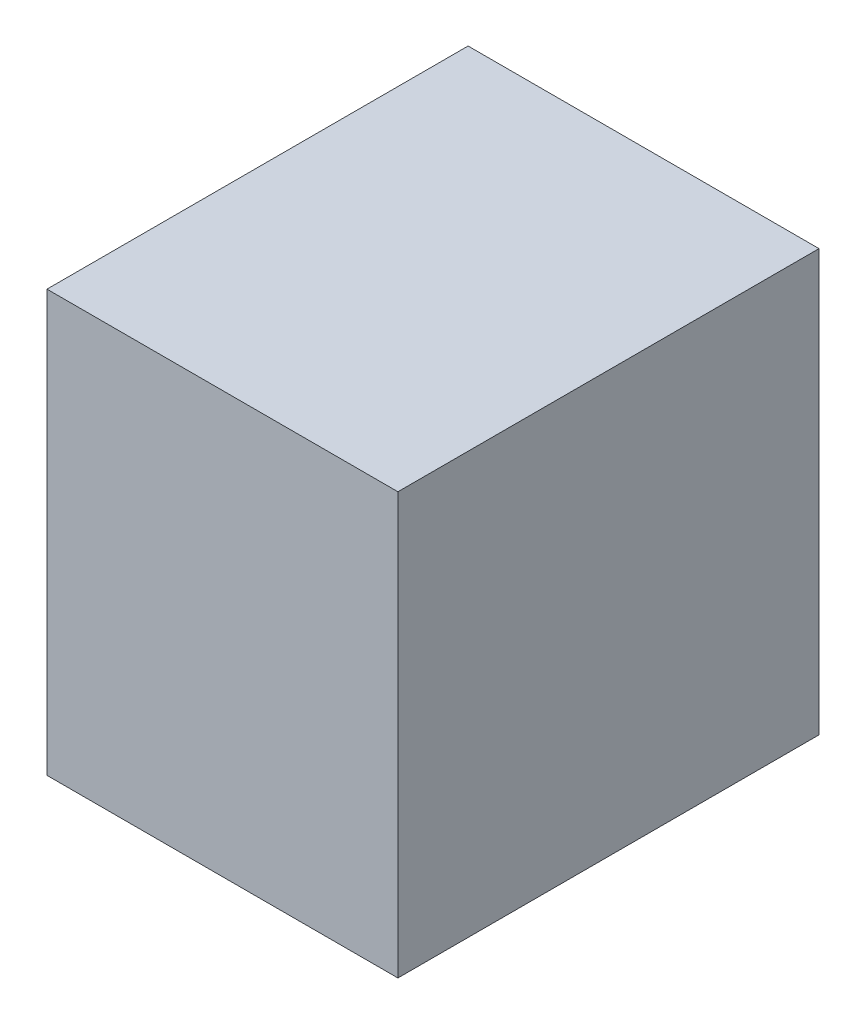
from build123d import *

# Parameters (mm, degrees)
PACK_FLAP_SERVO_25KGCM_2_1_START = -170
SKETCH1_W                        = 50
SKETCH1_H                        = 60
PACK_FLAP_SERVO_25KGCM_2_1_DEPTH = 60


with BuildPart() as part:
    # Sketch1 → PACK_flap_servo_25kgcm_2_1 (new body)
    with BuildSketch(Plane.XY.offset(PACK_FLAP_SERVO_25KGCM_2_1_START)):
        with Locations((350, 670)):
            Rectangle(SKETCH1_W, SKETCH1_H)
    extrude(amount=-PACK_FLAP_SERVO_25KGCM_2_1_DEPTH)


solid = part.part
